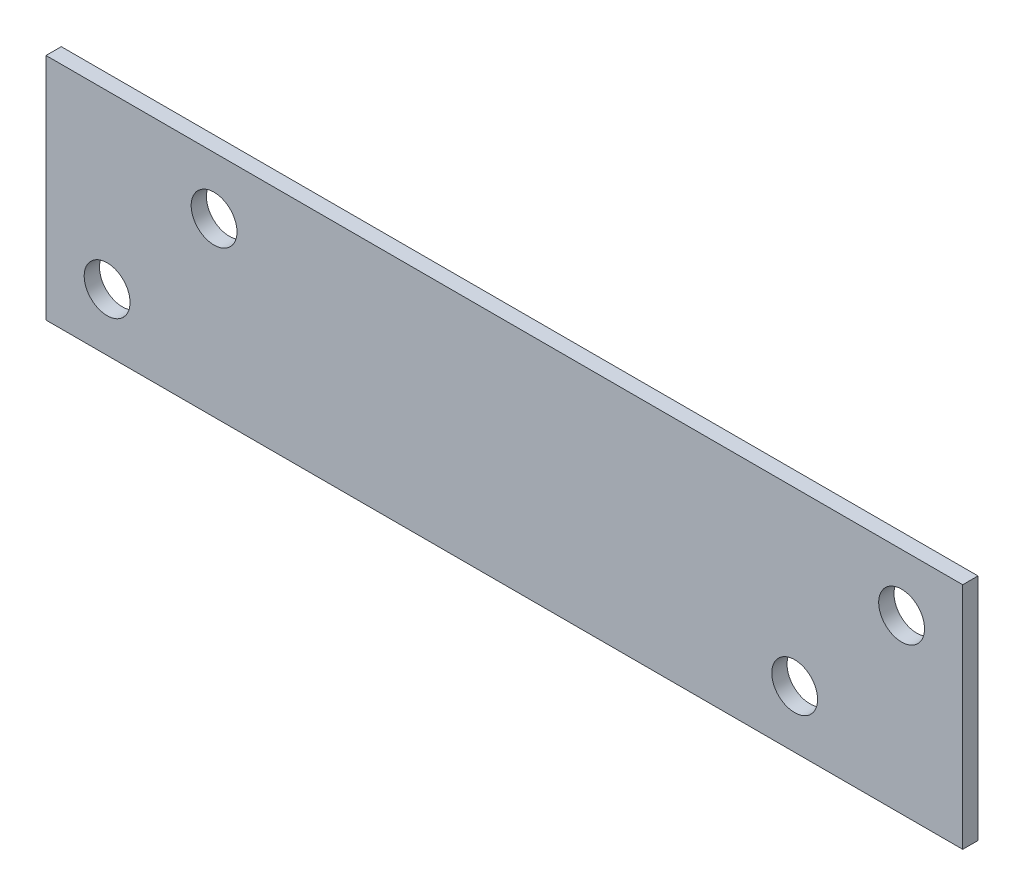
from build123d import *

# Parameters (mm, degrees)
ESQUISSE1_W        = 60
ESQUISSE1_H        = 15
ESQUISSE1_R        = 1.5
BOSS_EXTRU_1_DEPTH = 1


with BuildPart() as part:
    # Esquisse1 → Boss.-Extru.1 (new body)
    with BuildSketch(Plane.XY):
        with Locations((30, 7.5)):
            Rectangle(ESQUISSE1_W, ESQUISSE1_H)
        with Locations((11, 11.25)):
            Circle(ESQUISSE1_R, mode=Mode.SUBTRACT)
        with Locations((4, 3.75)):
            Circle(ESQUISSE1_R, mode=Mode.SUBTRACT)
        with Locations((56, 11.25)):
            Circle(ESQUISSE1_R, mode=Mode.SUBTRACT)
        with Locations((49, 3.75)):
            Circle(ESQUISSE1_R, mode=Mode.SUBTRACT)
    extrude(amount=-BOSS_EXTRU_1_DEPTH)


solid = part.part
